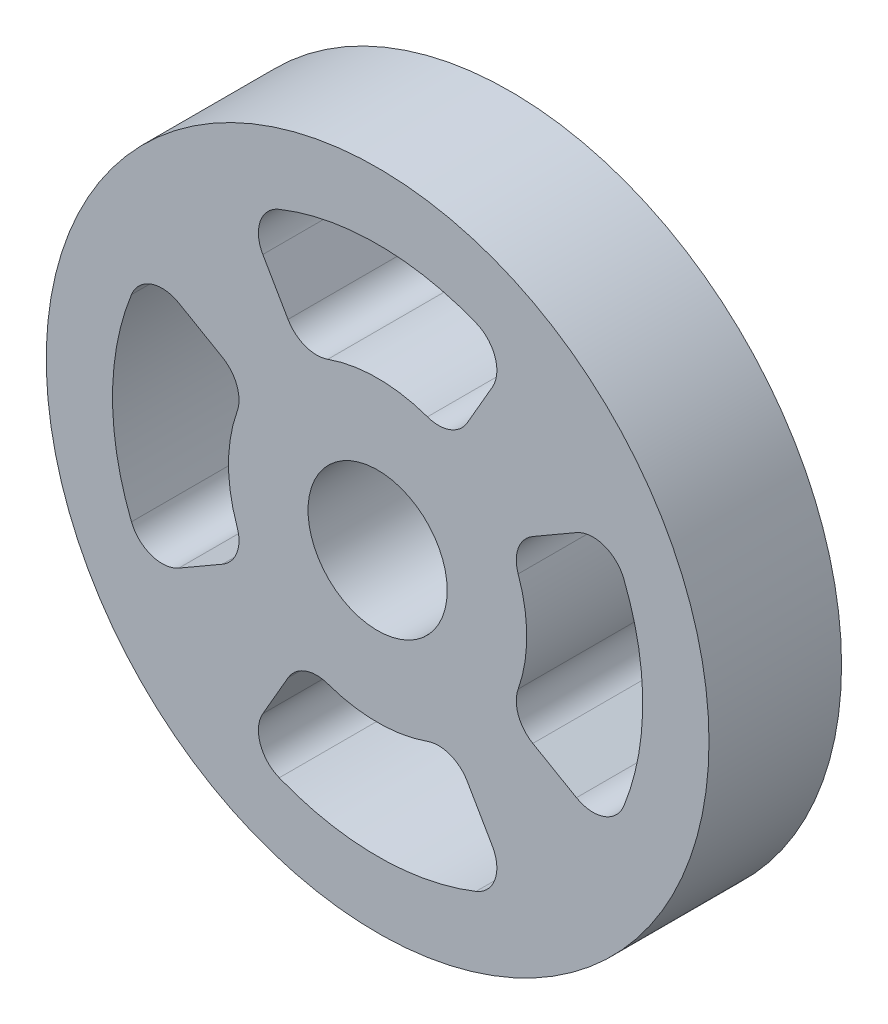
from build123d import *

# Parameters (mm, degrees)
BOSS_EXTRUDE1_DEPTH      = 20
BOSS_EXTRUDE1_DEPTH_BACK = 20
SKETCH1_R                = 30
SKETCH1_R_2              = 21
BOSS_EXTRUDE2_DEPTH      = 20
BOSS_EXTRUDE2_DEPTH_BACK = 20
SKETCH2_R                = 100
SKETCH2_R_2              = 21
CUT_EXTRUDE1_DEPTH       = 20
CUT_EXTRUDE1_DEPTH_BACK  = 20


with BuildPart() as part:
    # Sketch1 → Boss-Extrude1 (new, two sides: drawn at the far end of the back side and taken through both)
    with BuildSketch(Plane.XY.offset(-BOSS_EXTRUDE1_DEPTH_BACK)):
        Circle(SKETCH1_R)
        Circle(SKETCH1_R_2, mode=Mode.SUBTRACT)
    extrude(amount=BOSS_EXTRUDE1_DEPTH + BOSS_EXTRUDE1_DEPTH_BACK)

    # Sketch2 → Boss-Extrude2 (add, two sides: drawn at the far end of the back side and taken through both)
    with BuildSketch(Plane.XY.offset(-BOSS_EXTRUDE2_DEPTH_BACK)):
        Circle(SKETCH2_R)
        Circle(SKETCH2_R_2, mode=Mode.SUBTRACT)
    extrude(amount=BOSS_EXTRUDE2_DEPTH + BOSS_EXTRUDE2_DEPTH_BACK)

    # Sketch3 → Cut-Extrude1 (cut, two sides: drawn at the far end of the back side and taken through both)
    with BuildSketch(Plane.XY.offset(-CUT_EXTRUDE1_DEPTH_BACK)):
        with BuildLine():
            Line((-27.041634566, 46.837484988), (-34.641016151, 60))
            ThreePointArc((-34.641016151, 60), (-35.429873939, 68.273268354), (-29.692299558, 74.285714286))
            ThreePointArc((-29.692299558, 74.285714286), (0, 80), (29.692299558, 74.285714286))
            ThreePointArc((29.692299558, 74.285714286), (35.429873939, 68.273268354), (34.641016151, 60))
            Line((34.641016151, 60), (27.041634566, 46.837484988))
            ThreePointArc((27.041634566, 46.837484988), (21.840560017, 42.45483732), (15.039311341, 42.412487717))
            ThreePointArc((15.039311341, 42.412487717), (0, 45), (-15.039311341, 42.412487717))
            ThreePointArc((-15.039311341, 42.412487717), (-21.840560017, 42.45483732), (-27.041634566, 46.837484988))
        make_face()
        with BuildLine():
            Line((46.837484988, 27.041634566), (60, 34.641016151))
            ThreePointArc((60, 34.641016151), (68.273268354, 35.429873939), (74.285714286, 29.692299558))
            ThreePointArc((74.285714286, 29.692299558), (80, 0), (74.285714286, -29.692299558))
            ThreePointArc((74.285714286, -29.692299558), (68.273268354, -35.429873939), (60, -34.641016151))
            Line((60, -34.641016151), (46.837484988, -27.041634566))
            ThreePointArc((46.837484988, -27.041634566), (42.45483732, -21.840560017), (42.412487717, -15.039311341))
            ThreePointArc((42.412487717, -15.039311341), (45, 0), (42.412487717, 15.039311341))
            ThreePointArc((42.412487717, 15.039311341), (42.45483732, 21.840560017), (46.837484988, 27.041634566))
        make_face()
        with BuildLine():
            Line((27.041634566, -46.837484988), (34.641016151, -60))
            ThreePointArc((34.641016151, -60), (35.429873939, -68.273268354), (29.692299558, -74.285714286))
            ThreePointArc((29.692299558, -74.285714286), (0, -80), (-29.692299558, -74.285714286))
            ThreePointArc((-29.692299558, -74.285714286), (-35.429873939, -68.273268354), (-34.641016151, -60))
            Line((-34.641016151, -60), (-27.041634566, -46.837484988))
            ThreePointArc((-27.041634566, -46.837484988), (-21.840560017, -42.45483732), (-15.039311341, -42.412487717))
            ThreePointArc((-15.039311341, -42.412487717), (0, -45), (15.039311341, -42.412487717))
            ThreePointArc((15.039311341, -42.412487717), (21.840560017, -42.45483732), (27.041634566, -46.837484988))
        make_face()
        with BuildLine():
            Line((-46.837484988, -27.041634566), (-60, -34.641016151))
            ThreePointArc((-60, -34.641016151), (-68.273268354, -35.429873939), (-74.285714286, -29.692299558))
            ThreePointArc((-74.285714286, -29.692299558), (-80, 0), (-74.285714286, 29.692299558))
            ThreePointArc((-74.285714286, 29.692299558), (-68.273268354, 35.429873939), (-60, 34.641016151))
            Line((-60, 34.641016151), (-46.837484988, 27.041634566))
            ThreePointArc((-46.837484988, 27.041634566), (-42.45483732, 21.840560017), (-42.412487717, 15.039311341))
            ThreePointArc((-42.412487717, 15.039311341), (-45, 0), (-42.412487717, -15.039311341))
            ThreePointArc((-42.412487717, -15.039311341), (-42.45483732, -21.840560017), (-46.837484988, -27.041634566))
        make_face()
    extrude(amount=CUT_EXTRUDE1_DEPTH + CUT_EXTRUDE1_DEPTH_BACK, mode=Mode.SUBTRACT)


solid = part.part
